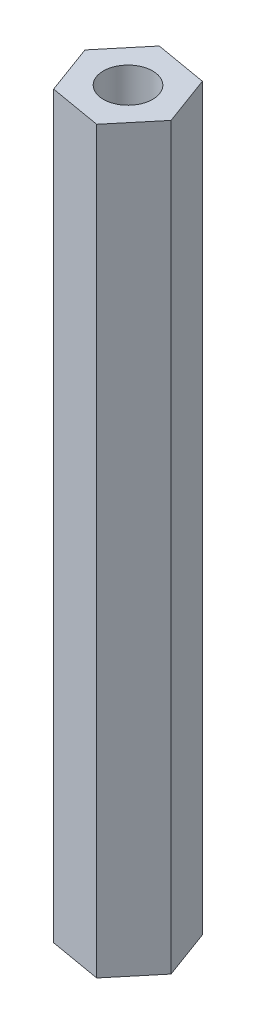
from build123d import *

# Parameters (mm, degrees)
SKETCH1_R           = 1.5
BOSS_EXTRUDE1_DEPTH = 45


with BuildPart() as part:
    # Sketch1 → Boss-Extrude1 (new body)
    with BuildSketch(Plane(origin=(0, 0, 0), x_dir=(1, 0, 0), z_dir=(0, 1, 0))):
        Polygon((1.111417275, -3.016021269), (3.167659675, -0.545495041), (2.0562424, 2.470526228), (-1.111417275, 3.016021269), (-3.167659675, 0.54549504), (-2.0562424, -2.470526228), align=None)
        with Locations(Location((0, 0, 0), (0, 0, 90))):
            Circle(SKETCH1_R, mode=Mode.SUBTRACT)
    extrude(amount=BOSS_EXTRUDE1_DEPTH)


solid = part.part
